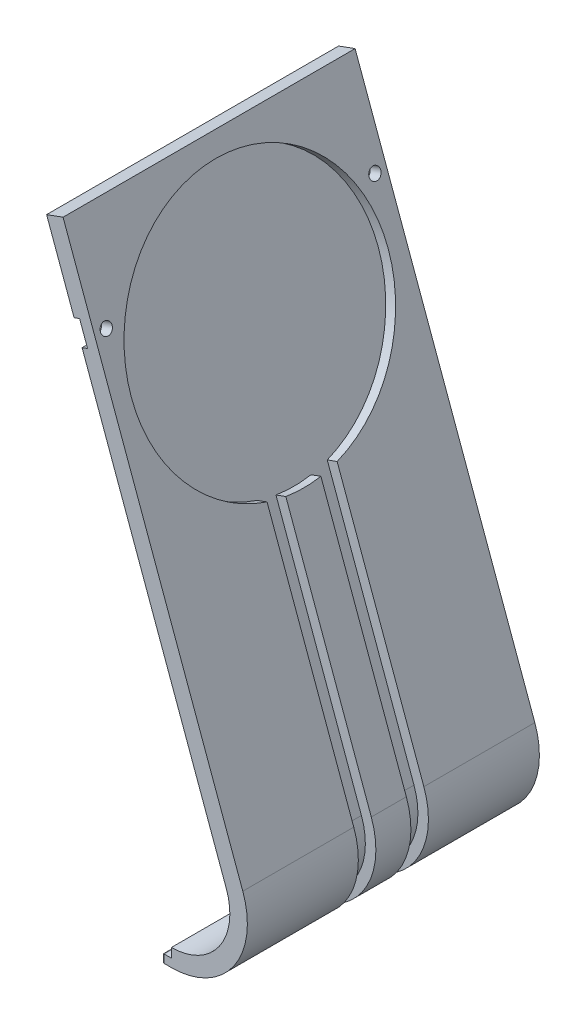
from build123d import *

# Parameters (mm, degrees)
EXTRUDE_1_DEPTH        = 25
SKETCH_4_R             = 22
CUT_EXTRUDE_1_DEPTH    = 1.8
CUT_EXTRUDE_START      = 6
CUT_EXTRUDE_1_2_DEPTH  = 3
SKETCH_11_W            = 18.9
SKETCH_11_H            = 1.4
EXTRUDE_3_DEPTH        = 1.5
FILLET_1_R             = 0.25
SKETCH_12_R            = 1
CUT_EXTRUDE_2553_DEPTH = 99.437390504
CUT_EXTRUDE_1_3_DEPTH  = 1


with BuildPart() as part:
    # 草图2 → 整体拉伸-薄壁1 (new, symmetric)
    with BuildSketch(Plane.XY):
        with BuildLine():
            ThreePointArc((28.874192719, 5.049687275), (37.065713162, 9.313922912), (38.271118927, 18.469888708))
            Line((38.271118927, 18.469888708), (7.496652644, 103.022039918))
            Line((7.496652644, 103.022039918), (10.315730506, 104.048100348))
            Line((10.315730506, 104.048100348), (41.090196789, 19.495949138))
            ThreePointArc((41.090196789, 19.495949138), (39.523169295, 7.593193603), (28.874192719, 2.049687275))
            Line((28.874192719, 2.049687275), (28.874192719, 5.049687275))
        make_face()
    extrude(amount=EXTRUDE_1_DEPTH, both=True)

    # 草图4 → Cut-Extrude 1 (cut)
    with BuildSketch(Plane(origin=(42.549434126, 15.486727507, 0), x_dir=(0, 0, -1), z_dir=(0.9396926207859071, 0.3420201433256726, 0))):
        with Locations(Location((0, 68.845044478, 0), (0, 0, 90))):
            Circle(SKETCH_4_R)
    extrude(amount=-CUT_EXTRUDE_1_DEPTH, mode=Mode.SUBTRACT)

    # 草图3 → Cut-Extrude 1 2 (cut)
    with BuildSketch(Plane.XY.offset(CUT_EXTRUDE_START)):
        with BuildLine():
            ThreePointArc((28.874192719, 3.849687275), (38.048695615, 8.625631188), (39.398750072, 18.88031288))
            Line((39.398750072, 18.88031288), (24.836038582, 58.891033865))
            Line((24.836038582, 58.891033865), (23.809978152, 61.710111727))
            Line((23.809978152, 61.710111727), (25.50142487, 62.325747985))
            Line((25.50142487, 62.325747985), (26.5274853, 59.506670123))
            Line((26.5274853, 59.506670123), (41.090196789, 19.495949138))
            ThreePointArc((41.090196789, 19.495949138), (39.523169295, 7.593193603), (28.874192719, 2.049687275))
            Line((28.874192719, 2.049687275), (28.874192719, 3.849687275))
        make_face()
    cut_extrude_1_2 = extrude(amount=-CUT_EXTRUDE_1_2_DEPTH, mode=Mode.SUBTRACT)

    # 镜向1: Cut-Extrude 1 2 across plane
    add(cut_extrude_1_2.mirror(Plane.XY), mode=Mode.SUBTRACT)

    # 草图11 → 底部卡扣凸台-拉伸3 (add)
    with BuildSketch(Plane.ZY.offset(-28.874192719)):
        with Locations((-15.55, 2.749687275)):
            Rectangle(SKETCH_11_W, SKETCH_11_H)
        with Locations((15.55, 2.749687275)):
            Rectangle(SKETCH_11_W, SKETCH_11_H)
    extrude(amount=EXTRUDE_3_DEPTH)

    # 底部卡扣圆角1
    fillet_1_edges = [part.edges().sort_by_distance(p)[0] for p in [
        (27.374192719, 2.749687275, -25),
        (27.374192719, 2.049687275, -15.55),
        (27.374192719, 2.749687275, -6.1),
        (27.374192719, 3.449687275, -15.55),
        (27.374192719, 2.749687275, 6.1),
        (27.374192719, 2.049687275, 15.55),
        (27.374192719, 2.749687275, 25),
        (27.374192719, 3.449687275, 15.55),
    ]]
    fillet(fillet_1_edges, radius=FILLET_1_R)

    # 草图12 → Cut-Extrude 2553 (cut, through all)
    with BuildSketch(Plane(origin=(39.730356264, 14.460667077, 0), x_dir=(0, 0, 1), z_dir=(-0.9396926207859071, -0.3420201433256726, 0))):
        with Locations(Location((23, 78.482840932, 0), (0, 0, 270))):
            Circle(SKETCH_12_R)
        with Locations(Location((-23, 78.482840932, 0), (0, 0, 270))):
            Circle(SKETCH_12_R)
    extrude(amount=-CUT_EXTRUDE_2553_DEPTH, mode=Mode.SUBTRACT)

    # 草图13 → Cut-Extrude 1 3 (cut)
    with BuildSketch(Plane(origin=(39.730356264, 14.460667077, 0), x_dir=(0, 0, 1), z_dir=(-0.9396926207859071, -0.3420201433256726, 0))):
        with BuildLine():
            Line((23, 80.482840932), (25, 80.482840932))
            Line((25, 80.482840932), (25, 76.482840932))
            Line((25, 76.482840932), (23, 76.482840932))
            ThreePointArc((23, 76.482840932), (21, 78.482840932), (23, 80.482840932))
        make_face()
        with BuildLine():
            Line((-25, 80.482840932), (-25, 76.482840932))
            Line((-25, 76.482840932), (-23, 76.482840932))
            ThreePointArc((-23, 76.482840932), (-21, 78.482840932), (-23, 80.482840932))
            Line((-23, 80.482840932), (-25, 80.482840932))
        make_face()
    extrude(amount=-CUT_EXTRUDE_1_3_DEPTH, mode=Mode.SUBTRACT)


solid = part.part
